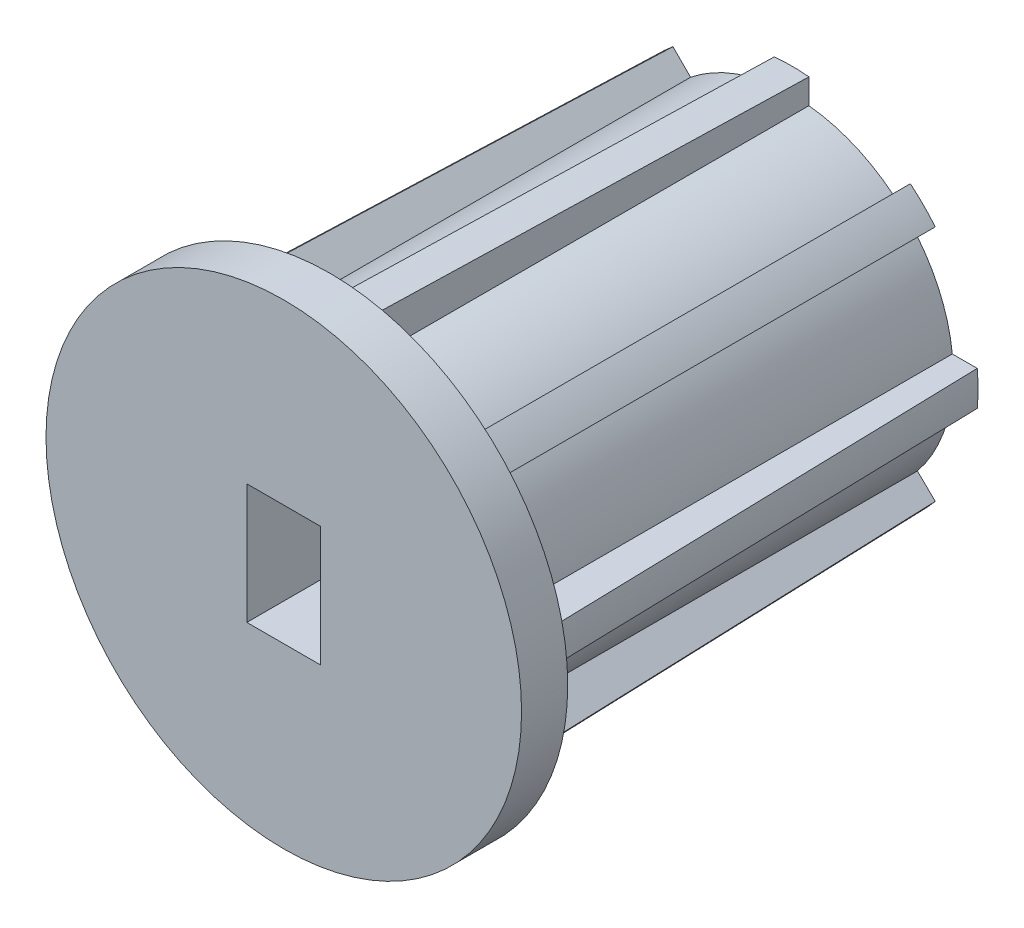
from build123d import *

# Parameters (mm, degrees)
SKETCH_1_R           = 20.6
EXTRUDE_1_DEPTH      = 4
EXTRUDE_2_DEPTH      = 1
EXTRUDE_2_DEPTH_BACK = 40
SKETCH_2_R           = 14
SKETCH_2_R_2         = 10
EXTRUDE_3_DEPTH      = 40
SKETCH_9_R           = 14
EXTRUDE_4_DEPTH      = 14
SKETCH_10_W          = 6.4
SKETCH_10_H          = 10.4
CUT_EXTRUDE_1_DEPTH  = 12
SCALE_1_SCALE        = 0.5


with BuildPart() as part:
    # Эскиз1 → Бобышка-Вытянуть1 (new body)
    with BuildSketch(Plane.XY):
        Circle(SKETCH_1_R)
    extrude(amount=EXTRUDE_1_DEPTH)



with BuildPart() as body_2:
    # Эскиз2 → Бобышка-Вытянуть2 (new, two sides: drawn at the far end of the back side and taken through both)
    with BuildSketch(Plane.XY.offset(-EXTRUDE_2_DEPTH_BACK)):
        Circle(SKETCH_2_R)
        Circle(SKETCH_2_R_2, mode=Mode.SUBTRACT)
    extrude(amount=EXTRUDE_2_DEPTH + EXTRUDE_2_DEPTH_BACK)


with BuildPart() as part_1:
    add(part.part)

    add(body_2.part)  # Бобышка-Вытянуть3 merges body 2
    # Эскиз3 → Бобышка-Вытянуть3 (add)
    with BuildSketch(Plane(origin=(0, 0, 0), x_dir=(-1, 0, 0), z_dir=(0, 0, -1))):
        with BuildLine():
            Line((-13.919410907, 1.5), (-17.134468186, 1.5))
            ThreePointArc((-17.134468186, 1.5), (-17.2, 0), (-17.134468186, -1.5))
            Line((-17.134468186, -1.5), (-13.919410907, -1.5))
            ThreePointArc((-13.919410907, -1.5), (-14, 0), (-13.919410907, 1.5))
        make_face()
        with BuildLine():
            Line((-13.198589674, 11.028926993), (-10.894370922, 8.792763059))
            ThreePointArc((-10.894370922, 8.792763059), (-9.881821028, 9.917137347), (-8.753841642, 10.925669613))
            Line((-8.753841642, 10.925669613), (-11.027747345, 13.199575315))
            ThreePointArc((-11.027747345, 13.199575315), (-12.161693133, 12.162780115), (-13.198589674, 11.028926993))
        make_face()
        with BuildLine():
            ThreePointArc((-8.753841642, -10.925669613), (-9.881821028, -9.917137347), (-10.894370922, -8.792763059))
            Line((-10.894370922, -8.792763059), (-13.198589674, -11.028926993))
            ThreePointArc((-13.198589674, -11.028926993), (-12.161693133, -12.162780115), (-11.027747345, -13.199575315))
            Line((-11.027747345, -13.199575315), (-8.753841642, -10.925669613))
        make_face()
        with BuildLine():
            Line((-1.5, 17.134468186), (-1.5, 13.919410907))
            ThreePointArc((-1.5, 13.919410907), (0, 14), (1.5, 13.919410907))
            Line((1.5, 13.919410907), (1.5, 17.134468186))
            ThreePointArc((1.5, 17.134468186), (0, 17.2), (-1.5, 17.134468186))
        make_face()
        with BuildLine():
            ThreePointArc((1.5, -13.919410907), (0, -14), (-1.5, -13.919410907))
            Line((-1.5, -13.919410907), (-1.5, -17.134468186))
            ThreePointArc((-1.5, -17.134468186), (0, -17.2), (1.5, -17.134468186))
            Line((1.5, -17.134468186), (1.5, -13.919410907))
        make_face()
        with BuildLine():
            Line((11.027747345, 13.199575315), (8.753841642, 10.925669613))
            ThreePointArc((8.753841642, 10.925669613), (9.881821028, 9.917137347), (10.894370922, 8.792763059))
            Line((10.894370922, 8.792763059), (13.198589674, 11.028926993))
            ThreePointArc((13.198589674, 11.028926993), (12.161693133, 12.162780115), (11.027747345, 13.199575315))
        make_face()
        with BuildLine():
            ThreePointArc((10.894370922, -8.792763059), (9.881821028, -9.917137347), (8.753841642, -10.925669613))
            Line((8.753841642, -10.925669613), (11.027747345, -13.199575315))
            ThreePointArc((11.027747345, -13.199575315), (12.161693133, -12.162780115), (13.198589674, -11.028926993))
            Line((13.198589674, -11.028926993), (10.894370922, -8.792763059))
        make_face()
        with BuildLine():
            Line((17.134468186, 1.5), (13.919410907, 1.5))
            ThreePointArc((13.919410907, 1.5), (14, 0), (13.919410907, -1.5))
            Line((13.919410907, -1.5), (17.134468186, -1.5))
            ThreePointArc((17.134468186, -1.5), (17.2, 0), (17.134468186, 1.5))
        make_face()
    extrude(amount=EXTRUDE_3_DEPTH)

    # Эскиз8 → Вырез-Повернуть2 (revolve, cut)
    with BuildSketch(Plane(origin=(0, 0, 0), x_dir=(0, 0, -1), z_dir=(1, 0, 0))):
        Polygon((40, 16.152563137), (0, 17.2), (40, 17.2), align=None)
    revolve(axis=Axis((0, 0, 0), (0, 0, -1)), mode=Mode.SUBTRACT)

    # Эскиз9 → Бобышка-Вытянуть4 (add)
    with BuildSketch(Plane(origin=(0, 0, 0), x_dir=(-1, 0, 0), z_dir=(0, 0, -1))):
        Circle(SKETCH_9_R)
    extrude(amount=EXTRUDE_4_DEPTH)

    # Эскиз10 → Вырез-Вытянуть1 (cut)
    with BuildSketch(Plane.XY.offset(4)):
        Rectangle(SKETCH_10_W, SKETCH_10_H)
    extrude(amount=-CUT_EXTRUDE_1_DEPTH, mode=Mode.SUBTRACT)


with BuildPart() as part_2:
    # Масштаб1: scaled about (0, 0, -13.067917949)
    add(part_1.part.scale(SCALE_1_SCALE).moved(Location((0, 0, -6.533958974))))


solid = part_2.part
